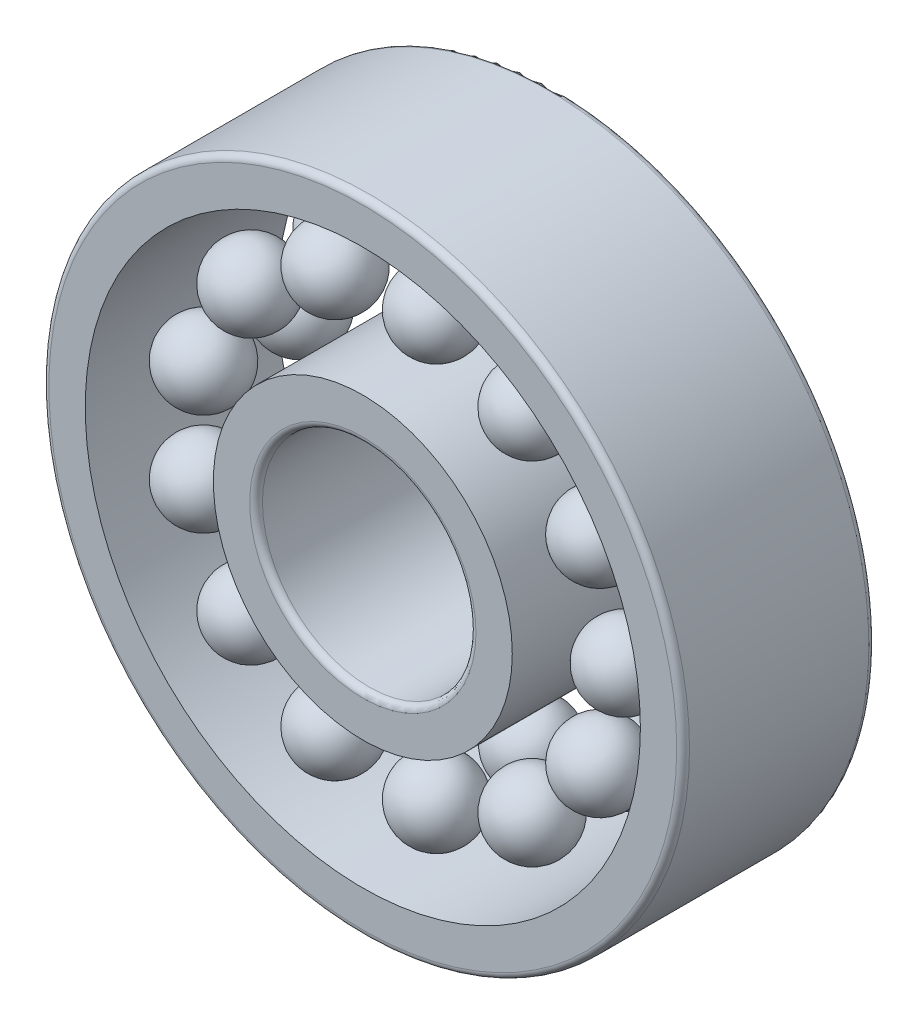
from build123d import *

# Parameters (mm, degrees)
INNERS_W            = 2
INNERS_H            = 9
OUTERS_W            = 2
OUTERS_H            = 9
BALL1SPATTERN_COUNT = 13
BALL2SPATTERN_COUNT = 13
FILLET_F1_R         = 0.3
FILLET_F2_R         = 0.3


with BuildPart() as part:
    # InnerS → InnerRing (revolve)
    with BuildSketch(Plane(origin=(0, 0, 0), x_dir=(1, 0, 0), z_dir=(0, 1, 0))):
        with Locations((6, 0)):
            Rectangle(INNERS_W, INNERS_H)
    revolve(axis=Axis((0, 0, 7.75), (0, 0, -1)))

    # Fillet F1
    fillet_f1_edges = [part.edges().sort_by_distance(p)[0] for p in [
        (-5, 0, -4.5),
        (-5, 0, 4.5),
    ]]
    fillet(fillet_f1_edges, radius=FILLET_F1_R)


with BuildPart() as body_2:
    # OuterS → OuterRing (revolve)
    with BuildSketch(Plane(origin=(0, 0, 0), x_dir=(1, 0, 0), z_dir=(0, 1, 0))):
        with Locations((14, 0)):
            Rectangle(OUTERS_W, OUTERS_H)
    revolve(axis=Axis((0, 0, 7.75), (0, 0, -1)))

    # Fillet F2
    fillet_f2_edges = [body_2.edges().sort_by_distance(p)[0] for p in [
        (-15, 0, -4.5),
        (-15, 0, 4.5),
    ]]
    fillet(fillet_f2_edges, radius=FILLET_F2_R)


with BuildPart() as body_3:
    # Ball1S → Ball1 (revolve)
    with BuildSketch(Plane(origin=(0, 0, 0), x_dir=(1, 0, 0), z_dir=(0, 1, 0))):
        with BuildLine():
            Line((8.2, 2.25), (11.8, 2.25))
            ThreePointArc((11.8, 2.25), (10, 0.45), (8.2, 2.25))
        make_face()
    revolve(axis=Axis((8.2, 0, -2.25), (1, 0, 0)))


with BuildPart() as ball1spattern_1:
    # Ball1sPattern: pattern copy
    add(body_3.part.rotate(Axis((0, 0, -4.95), (0, 0, 1)), 1 * 360 / BALL1SPATTERN_COUNT))


with BuildPart() as ball1spattern_2:
    # Ball1sPattern: pattern copy
    add(body_3.part.rotate(Axis((0, 0, -4.95), (0, 0, 1)), 2 * 360 / BALL1SPATTERN_COUNT))


with BuildPart() as ball1spattern_3:
    # Ball1sPattern: pattern copy
    add(body_3.part.rotate(Axis((0, 0, -4.95), (0, 0, 1)), 3 * 360 / BALL1SPATTERN_COUNT))


with BuildPart() as ball1spattern_4:
    # Ball1sPattern: pattern copy
    add(body_3.part.rotate(Axis((0, 0, -4.95), (0, 0, 1)), 4 * 360 / BALL1SPATTERN_COUNT))


with BuildPart() as ball1spattern_5:
    # Ball1sPattern: pattern copy
    add(body_3.part.rotate(Axis((0, 0, -4.95), (0, 0, 1)), 5 * 360 / BALL1SPATTERN_COUNT))


with BuildPart() as ball1spattern_6:
    # Ball1sPattern: pattern copy
    add(body_3.part.rotate(Axis((0, 0, -4.95), (0, 0, 1)), 6 * 360 / BALL1SPATTERN_COUNT))


with BuildPart() as ball1spattern_7:
    # Ball1sPattern: pattern copy
    add(body_3.part.rotate(Axis((0, 0, -4.95), (0, 0, 1)), 7 * 360 / BALL1SPATTERN_COUNT))


with BuildPart() as ball1spattern_8:
    # Ball1sPattern: pattern copy
    add(body_3.part.rotate(Axis((0, 0, -4.95), (0, 0, 1)), 8 * 360 / BALL1SPATTERN_COUNT))


with BuildPart() as ball1spattern_9:
    # Ball1sPattern: pattern copy
    add(body_3.part.rotate(Axis((0, 0, -4.95), (0, 0, 1)), 9 * 360 / BALL1SPATTERN_COUNT))


with BuildPart() as ball1spattern_10:
    # Ball1sPattern: pattern copy
    add(body_3.part.rotate(Axis((0, 0, -4.95), (0, 0, 1)), 10 * 360 / BALL1SPATTERN_COUNT))


with BuildPart() as ball1spattern_11:
    # Ball1sPattern: pattern copy
    add(body_3.part.rotate(Axis((0, 0, -4.95), (0, 0, 1)), 11 * 360 / BALL1SPATTERN_COUNT))


with BuildPart() as ball1spattern_12:
    # Ball1sPattern: pattern copy
    add(body_3.part.rotate(Axis((0, 0, -4.95), (0, 0, 1)), 12 * 360 / BALL1SPATTERN_COUNT))


with BuildPart() as body_16:
    # Ball2S → Ball2 (revolve)
    with BuildSketch(Plane(origin=(0, 0, 0), x_dir=(1, 0, 0), z_dir=(0, 1, 0))):
        with BuildLine():
            Line((8.2, -2.25), (11.8, -2.25))
            ThreePointArc((11.8, -2.25), (10, -4.05), (8.2, -2.25))
        make_face()
    revolve(axis=Axis((8.2, 0, 2.25), (1, 0, 0)))


with BuildPart() as ball2spattern_1:
    # Ball2sPattern: pattern copy
    add(body_16.part.rotate(Axis((0, 0, -4.95), (0, 0, 1)), 1 * 360 / BALL2SPATTERN_COUNT))


with BuildPart() as ball2spattern_2:
    # Ball2sPattern: pattern copy
    add(body_16.part.rotate(Axis((0, 0, -4.95), (0, 0, 1)), 2 * 360 / BALL2SPATTERN_COUNT))


with BuildPart() as ball2spattern_3:
    # Ball2sPattern: pattern copy
    add(body_16.part.rotate(Axis((0, 0, -4.95), (0, 0, 1)), 3 * 360 / BALL2SPATTERN_COUNT))


with BuildPart() as ball2spattern_4:
    # Ball2sPattern: pattern copy
    add(body_16.part.rotate(Axis((0, 0, -4.95), (0, 0, 1)), 4 * 360 / BALL2SPATTERN_COUNT))


with BuildPart() as ball2spattern_5:
    # Ball2sPattern: pattern copy
    add(body_16.part.rotate(Axis((0, 0, -4.95), (0, 0, 1)), 5 * 360 / BALL2SPATTERN_COUNT))


with BuildPart() as ball2spattern_6:
    # Ball2sPattern: pattern copy
    add(body_16.part.rotate(Axis((0, 0, -4.95), (0, 0, 1)), 6 * 360 / BALL2SPATTERN_COUNT))


with BuildPart() as ball2spattern_7:
    # Ball2sPattern: pattern copy
    add(body_16.part.rotate(Axis((0, 0, -4.95), (0, 0, 1)), 7 * 360 / BALL2SPATTERN_COUNT))


with BuildPart() as ball2spattern_8:
    # Ball2sPattern: pattern copy
    add(body_16.part.rotate(Axis((0, 0, -4.95), (0, 0, 1)), 8 * 360 / BALL2SPATTERN_COUNT))


with BuildPart() as ball2spattern_9:
    # Ball2sPattern: pattern copy
    add(body_16.part.rotate(Axis((0, 0, -4.95), (0, 0, 1)), 9 * 360 / BALL2SPATTERN_COUNT))


with BuildPart() as ball2spattern_10:
    # Ball2sPattern: pattern copy
    add(body_16.part.rotate(Axis((0, 0, -4.95), (0, 0, 1)), 10 * 360 / BALL2SPATTERN_COUNT))


with BuildPart() as ball2spattern_11:
    # Ball2sPattern: pattern copy
    add(body_16.part.rotate(Axis((0, 0, -4.95), (0, 0, 1)), 11 * 360 / BALL2SPATTERN_COUNT))


with BuildPart() as ball2spattern_12:
    # Ball2sPattern: pattern copy
    add(body_16.part.rotate(Axis((0, 0, -4.95), (0, 0, 1)), 12 * 360 / BALL2SPATTERN_COUNT))


solid = Compound([part.part, body_2.part, body_3.part, ball1spattern_1.part, ball1spattern_2.part, ball1spattern_3.part, ball1spattern_4.part, ball1spattern_5.part, ball1spattern_6.part, ball1spattern_7.part, ball1spattern_8.part, ball1spattern_9.part, ball1spattern_10.part, ball1spattern_11.part, ball1spattern_12.part, body_16.part, ball2spattern_1.part, ball2spattern_2.part, ball2spattern_3.part, ball2spattern_4.part, ball2spattern_5.part, ball2spattern_6.part, ball2spattern_7.part, ball2spattern_8.part, ball2spattern_9.part, ball2spattern_10.part, ball2spattern_11.part, ball2spattern_12.part])
